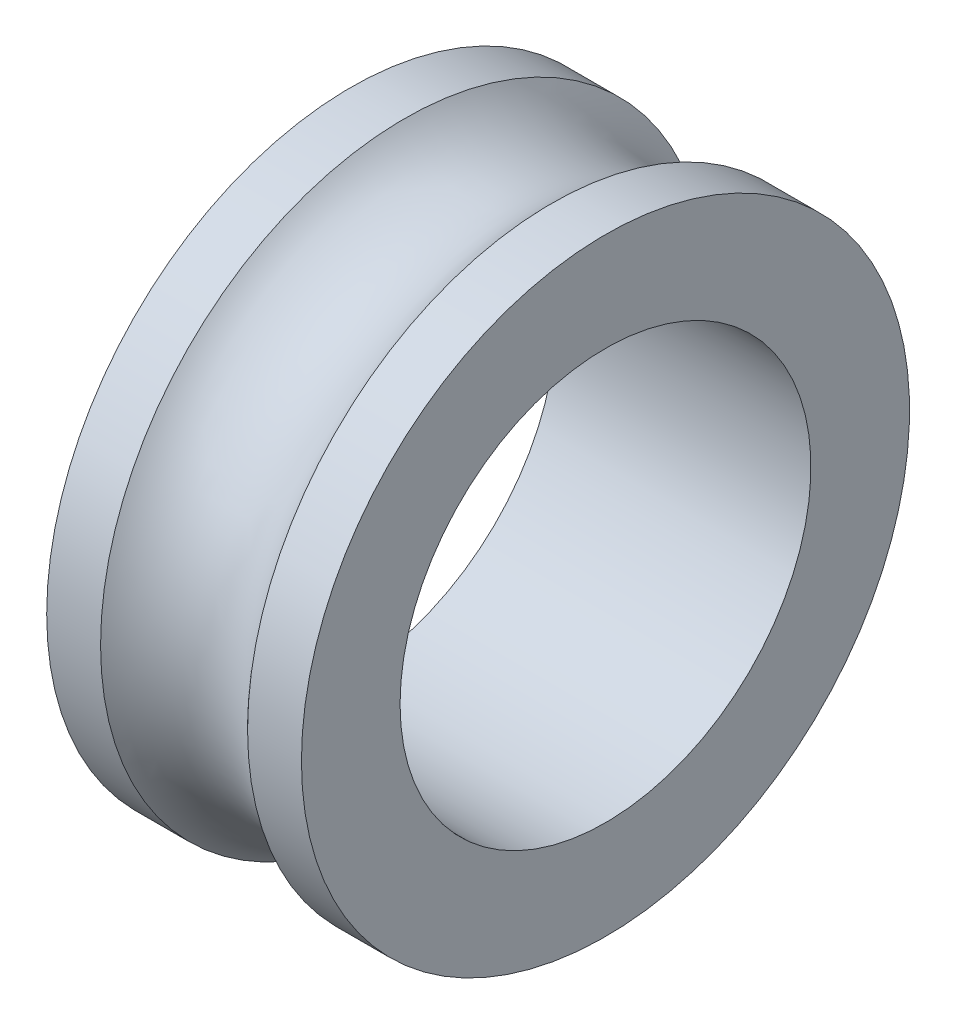
from build123d import *


with BuildPart() as part:
    # Sketch2 → Revolve1 (revolve)
    with BuildSketch(Plane.XY, mode=Mode.PRIVATE) as revolve1_sk:
        with BuildLine():
            Line((-6.55572809, 18.079341317), (0, 18.079341317))
            Line((0, 18.079341317), (0, 6.079341317))
            Line((0, 6.079341317), (-31, 6.079341317))
            Line((-31, 6.079341317), (-31, 18.079341317))
            Line((-31, 18.079341317), (-24.44427191, 18.079341317))
            ThreePointArc((-24.44427191, 18.079341317), (-15.5, 14.079341317), (-6.55572809, 18.079341317))
        make_face()
    revolve(revolve1_sk.sketch.rotate(Axis((-31.185628743, -18.920658683, 0), (1, 0, 0)), 90), axis=Axis((-31.185628743, -18.920658683, 0), (1, 0, 0)))


solid = part.part
